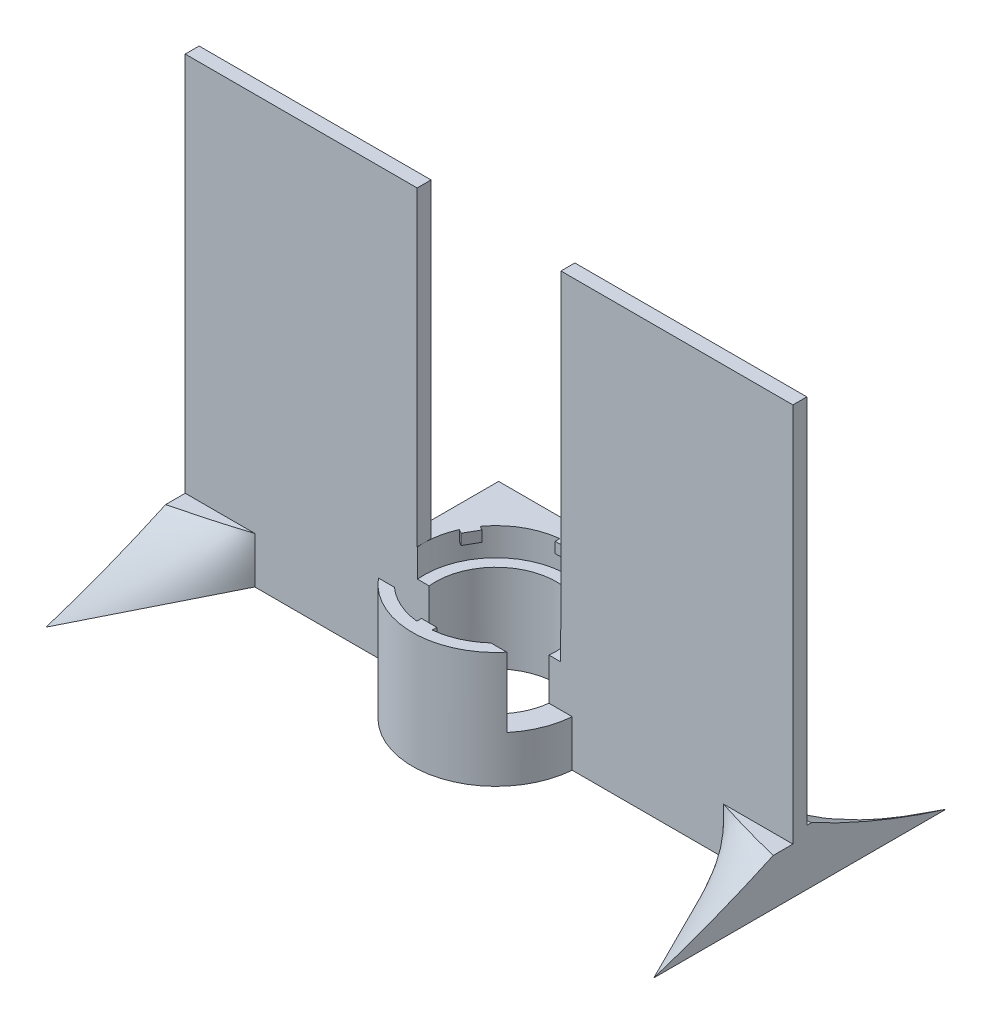
from build123d import *

# Parameters (mm, degrees)
SKETCH1_W               = 3
SKETCH1_H               = 80
BOSS_EXTRUDE1_DEPTH     = 50
SKETCH6_W               = 3
SKETCH6_H               = 12
BOSS_EXTRUDE2_DEPTH     = 35
SKETCH14_R              = 18
SKETCH14_R_2            = 15.5
BOSS_EXTRUDE3_DEPTH     = 25
BOSS_EXTRUDE4_DEPTH     = 2.3
CIRPATTERN1_COUNT       = 6
BOSS_EXTRUDE5_START     = -25
BOSS_EXTRUDE5_DEPTH     = 25
BOSS_EXTRUDE6_START     = -25
SKETCH17_R              = 15.5
SKETCH17_R_2            = 13
BOSS_EXTRUDE6_DEPTH     = 19
CUT_EXTRUDE1_DEPTH      = 118.245469157
CUT_EXTRUDE1_DEPTH_BACK = 118.245469157
SKETCH18_W              = 10
SKETCH18_H              = 15


with BuildPart() as part:
    # Sketch1 → Boss-Extrude1 (new body)
    with BuildSketch(Plane(origin=(15.5, 0, 0), x_dir=(0, 0, -1), z_dir=(1, 0, 0))):
        with Locations((0, 52)):
            Rectangle(SKETCH1_W, SKETCH1_H)
    extrude(amount=BOSS_EXTRUDE1_DEPTH)

    # Sketch6 → Boss-Extrude2 (add)
    with BuildSketch(Plane.ZY.offset(-15.5)):
        with Locations((0, 6)):
            Rectangle(SKETCH6_W, SKETCH6_H)
    extrude(amount=-BOSS_EXTRUDE2_DEPTH)

    # Sketch7 → Loft3 section 0
    with BuildSketch(Plane(origin=(50.5, 0, 0), x_dir=(0, 0, -1), z_dir=(1, 0, 0))):
        with BuildLine():
            Line((-1.5, 12), (1.5, 12))
            Line((1.5, 12), (1.5, 0))
            Line((1.5, 0), (-1.5, 0))
            Line((-1.5, 0), (-1.5, 12))
        make_face()
    # Sketch5 → Loft3 section 1
    with BuildSketch(Plane(origin=(65.5, 0, 0), x_dir=(0, 0, -1), z_dir=(1, 0, 0))):
        with BuildLine():
            Line((-1.5, 12), (2.5, 12))
            add(Edge.make_bspline(
                [(2.5, 12), (16.446218703, 4.628977133), (31.5, 0)],
                knots=[0, 0, 0, 1, 1, 1], degree=2))
            Line((31.5, 0), (-31.5, 0))
            add(Edge.make_bspline(
                [(-1.5, 12), (-16.07182757, 4.906260237), (-31.5, 0)],
                knots=[0, 0, 0, 1, 1, 1], degree=2))
        make_face()
    loft()


with BuildPart() as body_2:
    # Mirror3: mirrored copy
    add(part.part.mirror(Plane(origin=(0, 0, 0), x_dir=(0, 0, 1), z_dir=(1, 0, 0))))


with BuildPart() as part_1:
    add(part.part)

    add(body_2.part)  # Boss-Extrude3 merges body 2
    # Sketch14 → Boss-Extrude3 (add)
    with BuildSketch(Plane(origin=(0, 0, 0), x_dir=(1, 0, 0), z_dir=(0, 1, 0))):
        Circle(SKETCH14_R)
        with Locations(Location((0, 0, 0), (0, 0, 180))):
            Circle(SKETCH14_R_2, mode=Mode.SUBTRACT)
    extrude(amount=BOSS_EXTRUDE3_DEPTH)

    # Sketch15 → Boss-Extrude4 (add)
    with BuildSketch(Plane(origin=(0, 25, 0), x_dir=(1, 0, 0), z_dir=(0, 1, 0))):
        Polygon((-1.65, 15.411927199), (-1.65, 14.411927199), (1.65, 14.411927199), (1.65, 15.411927199), (0, 16.251375975), align=None)
    boss_extrude4 = extrude(amount=-BOSS_EXTRUDE4_DEPTH)

    # CirPattern1: Boss-Extrude4 ×6 about axis
    cirpattern1_axis = Axis((0, 0, 0), (0, 1, 0))
    for i in range(1, CIRPATTERN1_COUNT):
        add(boss_extrude4.rotate(cirpattern1_axis, i * 360 / CIRPATTERN1_COUNT))

    # Sketch16 → Boss-Extrude5 (add)
    with BuildSketch(Plane(origin=(0, 25, 0), x_dir=(1, 0, 0), z_dir=(0, 1, 0)).offset(BOSS_EXTRUDE5_START)):
        with BuildLine():
            Line((-18.937391115, 1.5), (-18.937391115, 19.5))
            Line((-18.937391115, 19.5), (18.937391115, 19.5))
            Line((18.937391115, 19.5), (18.937391115, 1.5))
            Line((18.937391115, 1.5), (17.937391115, 1.5))
            ThreePointArc((17.937391115, 1.5), (0, 18), (-17.937391115, 1.5))
            Line((-17.937391115, 1.5), (-18.937391115, 1.5))
        make_face()
    extrude(amount=BOSS_EXTRUDE5_DEPTH)

    # Sketch17 → Boss-Extrude6 (add)
    with BuildSketch(Plane(origin=(0, 25, 0), x_dir=(1, 0, 0), z_dir=(0, 1, 0)).offset(BOSS_EXTRUDE6_START)):
        with Locations(Location((0, 0, 0), (0, 0, 96.110806636))):
            Circle(SKETCH17_R)
        with Locations(Location((0, 0, 0), (0, 0, 270))):
            Circle(SKETCH17_R_2, mode=Mode.SUBTRACT)
    extrude(amount=BOSS_EXTRUDE6_DEPTH)

    # Sketch18 → Cut-Extrude1 (cut, two sides: drawn at the far end of the back side and taken through both)
    with BuildSketch(Plane(origin=(0, 0, 0), x_dir=(0, 0, -1), z_dir=(1, 0, 0)).offset(-CUT_EXTRUDE1_DEPTH_BACK)):
        with Locations((-6.5, 17.5)):
            Rectangle(SKETCH18_W, SKETCH18_H)
    extrude(amount=CUT_EXTRUDE1_DEPTH + CUT_EXTRUDE1_DEPTH_BACK, mode=Mode.SUBTRACT)


solid = part_1.part
